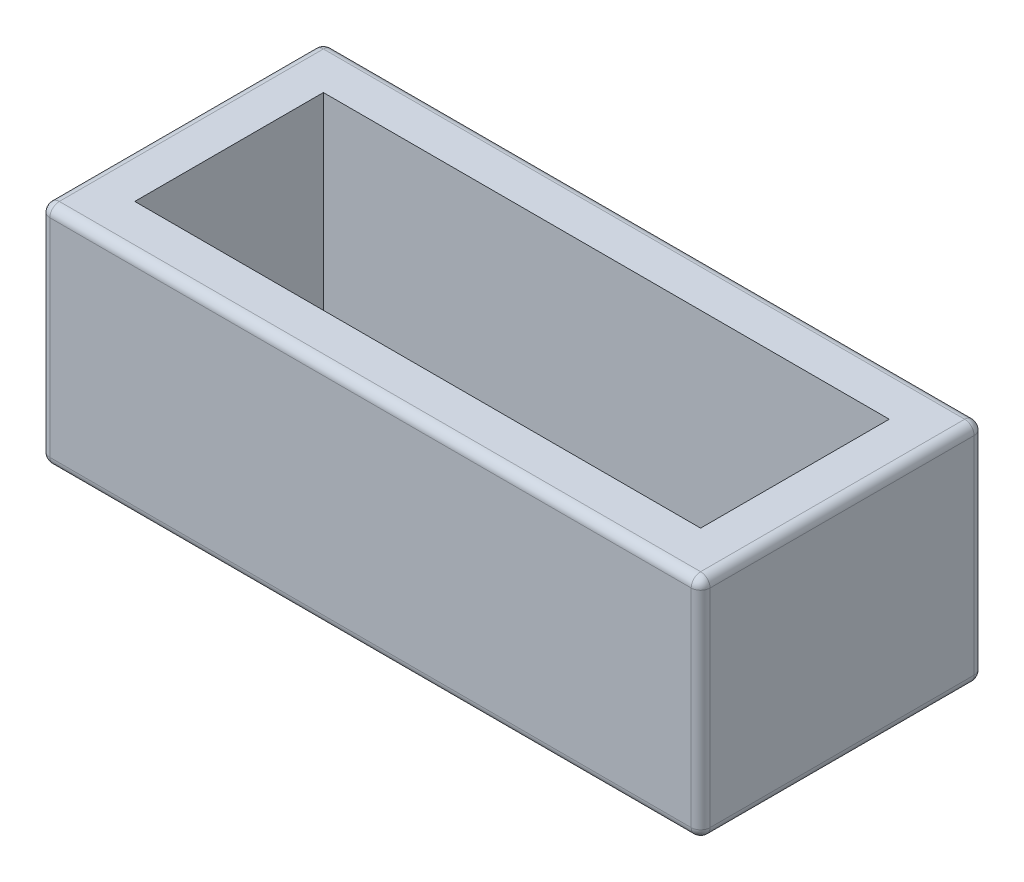
from build123d import *

# Parameters (mm, degrees)
SKETCH1_W           = 35
SKETCH1_H           = 15
BOSS_EXTRUDE1_DEPTH = 12
SHELL1_T            = -2.5
FILLET1_R           = 0.5
SKETCH3_W           = 30
SKETCH3_H           = 10
CUT_EXTRUDE1_DEPTH  = 0.5


with BuildPart() as part:
    # Sketch1 → Boss-Extrude1 (new body)
    with BuildSketch(Plane(origin=(0, 0, 0), x_dir=(1, 0, 0), z_dir=(0, 1, 0))):
        with Locations((17.5, 7.5)):
            Rectangle(SKETCH1_W, SKETCH1_H)
    extrude(amount=BOSS_EXTRUDE1_DEPTH)

    # Shell1
    shell1_openings = [part.faces().sort_by_distance(p)[0] for p in [
        (17.5, 12, -7.5),
    ]]
    offset(amount=SHELL1_T, openings=shell1_openings, kind=Kind.INTERSECTION)

    # Fillet1
    fillet1_edges = [part.edges().sort_by_distance(p)[0] for p in [
        (35, 12, -7.5),
        (17.5, 12, -15),
        (0, 12, -7.5),
        (17.5, 0, -15),
        (35, 0, -7.5),
        (17.5, 0, 0),
        (0, 0, -7.5),
        (17.5, 12, 0),
        (0, 6, -15),
        (35, 6, -15),
        (35, 6, 0),
        (0, 6, 0),
    ]]
    fillet(fillet1_edges, radius=FILLET1_R)

    # Sketch3 → Cut-Extrude1 (cut)
    with BuildSketch(Plane(origin=(0, 2.5, 0), x_dir=(1, 0, 0), z_dir=(0, 1, 0))):
        with Locations((17.5, 7.5)):
            Rectangle(SKETCH3_W, SKETCH3_H)
    extrude(amount=-CUT_EXTRUDE1_DEPTH, mode=Mode.SUBTRACT)


solid = part.part
